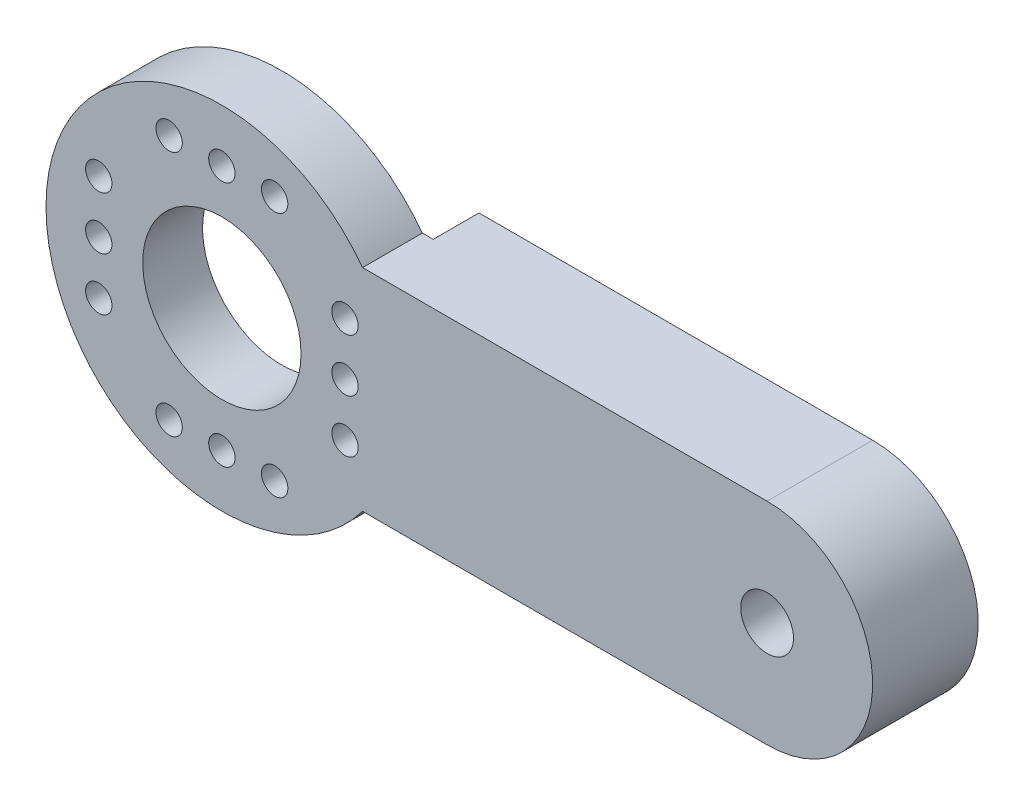
from build123d import *

# Parameters (mm, degrees)
EXTRUDE_1_DEPTH     = 6
SKETCH_7_R          = 1.5
CUT_EXTRUDE_3_DEPTH = 31
CUT_EXTRUDE_START   = -2.6
SKETCH_8_R          = 10.5
CUT_EXTRUDE_4_DEPTH = 2.6
SKETCH_9_R          = 0.75
CUT_EXTRUDE_5_DEPTH = 10
SKETCH_10_R         = 4.5
CUT_EXTRUDE_6_DEPTH = 10


with BuildPart() as part:
    # 草图2 → 凸台-拉伸1 (new body)
    with BuildSketch(Plane.XY):
        with BuildLine():
            Line((-5.050750258, -65.386258364), (17.949249742, -65.386258364))
            ThreePointArc((17.949249742, -65.386258364), (23.949249742, -71.386258364), (17.949249742, -77.386258364))
            Line((17.949249742, -77.386258364), (-5.050750258, -77.386258364))
            ThreePointArc((-5.050750258, -77.386258364), (-23.050750258, -71.386258364), (-5.050750258, -65.386258364))
        make_face()
    extrude(amount=-EXTRUDE_1_DEPTH)

    # 草图7 → 切除-拉伸3 (cut)
    with BuildSketch(Plane.XY):
        with Locations((17.949249742, -71.386258364)):
            Circle(SKETCH_7_R)
    extrude(amount=-CUT_EXTRUDE_3_DEPTH, mode=Mode.SUBTRACT)

    # 草图8 → 切除-拉伸4 (cut)
    with BuildSketch(Plane(origin=(0, 0, -6), x_dir=(-1, 0, 0), z_dir=(0, 0, -1)).offset(CUT_EXTRUDE_START)):
        with Locations((13.050750258, -71.386258364)):
            Circle(SKETCH_8_R)
    extrude(amount=CUT_EXTRUDE_4_DEPTH, mode=Mode.SUBTRACT)

    # 草图9 → 切除-拉伸5 (cut)
    with BuildSketch(Plane(origin=(0, 0, -3.4), x_dir=(-1, 0, 0), z_dir=(0, 0, -1))):
        with Locations(Location((6.050750258, -71.386258364, 0), (0, 0, 90))):
            Circle(SKETCH_9_R)
        with Locations(Location((6.050750258, -74.386258364, 0), (0, 0, 90))):
            Circle(SKETCH_9_R)
        with Locations(Location((6.050750258, -68.386258364, 0), (0, 0, 90))):
            Circle(SKETCH_9_R)
        with Locations(Location((10.050750258, -78.386258364, 0), (0, 0, 90))):
            Circle(SKETCH_9_R)
        with Locations(Location((13.050750258, -78.386258364, 0), (0, 0, 90))):
            Circle(SKETCH_9_R)
        with Locations(Location((16.050750258, -78.386258364, 0), (0, 0, 90))):
            Circle(SKETCH_9_R)
        with Locations(Location((20.050750258, -74.386258364, 0), (0, 0, 90))):
            Circle(SKETCH_9_R)
        with Locations(Location((20.050750258, -71.386258364, 0), (0, 0, 90))):
            Circle(SKETCH_9_R)
        with Locations(Location((20.050750258, -68.386258364, 0), (0, 0, 90))):
            Circle(SKETCH_9_R)
        with Locations(Location((16.050750258, -64.386258364, 0), (0, 0, 90))):
            Circle(SKETCH_9_R)
        with Locations(Location((13.050750258, -64.386258364, 0), (0, 0, 90))):
            Circle(SKETCH_9_R)
        with Locations(Location((10.050750258, -64.386258364, 0), (0, 0, 90))):
            Circle(SKETCH_9_R)
    extrude(amount=-CUT_EXTRUDE_5_DEPTH, mode=Mode.SUBTRACT)

    # 草图10 → 切除-拉伸6 (cut)
    with BuildSketch(Plane(origin=(0, 0, -3.4), x_dir=(-1, 0, 0), z_dir=(0, 0, -1))):
        with Locations(Location((13.050750258, -71.386258364, 0), (0, 0, 90))):
            Circle(SKETCH_10_R)
    extrude(amount=-CUT_EXTRUDE_6_DEPTH, mode=Mode.SUBTRACT)


solid = part.part
